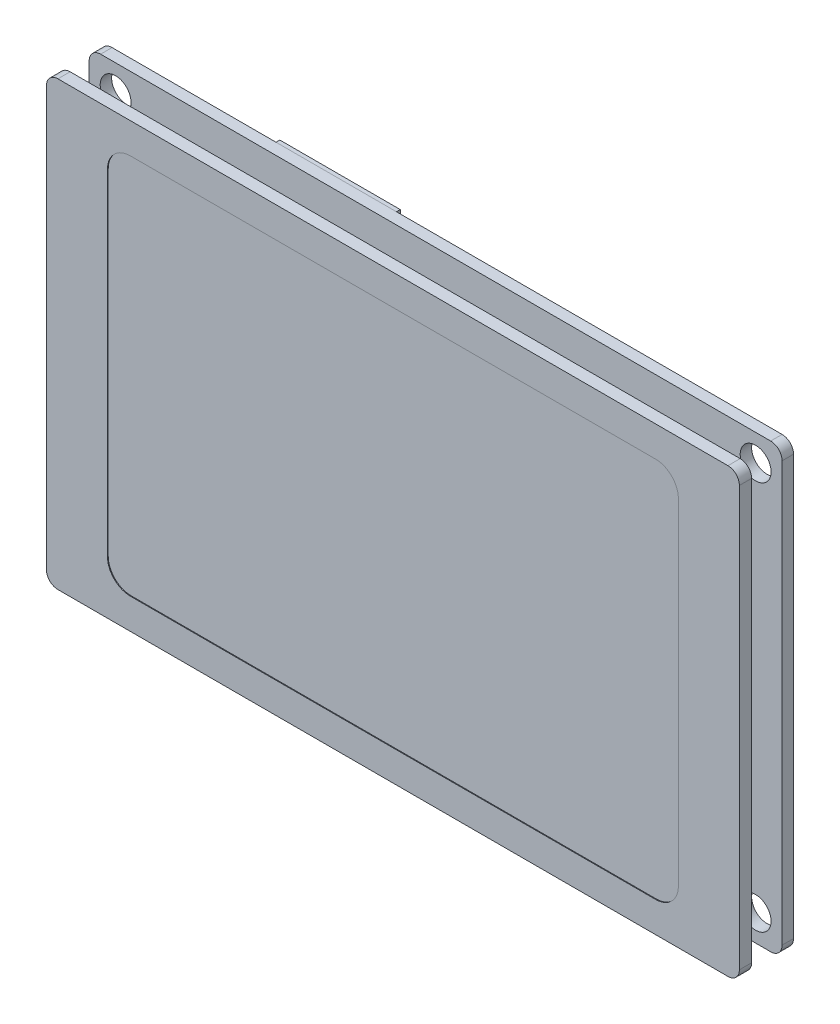
from build123d import *

# Parameters (mm, degrees)
SKETCH1_W             = 90.87
SKETCH1_H             = 58.01
SKETCH1_R             = 2.025
BOSS_EXTRUDE1_DEPTH   = 1.5
FILLET1_R             = 1.5
SKETCH2_W             = 4.5
SKETCH2_H             = 40.5
SKETCH2_W_2           = 1.5
SKETCH2_H_2           = 1.5
BOSS_EXTRUDE2_DEPTH   = 5
SKETCH2_W_3           = 40.5
SKETCH2_H_3           = 4.5
BOSS_EXTRUDE2_2_DEPTH = 5
SKETCH3_W             = 15.8
SKETCH3_H             = 31.3
BOSS_EXTRUDE3_DEPTH   = 0.5
BOSS_EXTRUDE4_DEPTH   = 2.7
SKETCH5_W             = 80
SKETCH5_H             = 45
BOSS_EXTRUDE5_DEPTH   = 4
BOSS_EXTRUDE6_DEPTH   = 1.6
CUT_EXTRUDE1_DEPTH    = 0.1


with BuildPart() as part:
    # Sketch1 → Boss-Extrude1 (new body)
    with BuildSketch(Plane.XY):
        Rectangle(SKETCH1_W, SKETCH1_H)
        with Locations((-41.965, 25.515)):
            Circle(SKETCH1_R, mode=Mode.SUBTRACT)
        with Locations(Location((-41.965, -25.515, 0), (0, 0, 180))):
            Circle(SKETCH1_R, mode=Mode.SUBTRACT)
        with Locations((41.965, -25.515)):
            Circle(SKETCH1_R, mode=Mode.SUBTRACT)
        with Locations(Location((41.965, 25.515, 0), (0, 0, 180))):
            Circle(SKETCH1_R, mode=Mode.SUBTRACT)
    extrude(amount=BOSS_EXTRUDE1_DEPTH)

    # Fillet1
    fillet1_edges = [part.edges().sort_by_distance(p)[0] for p in [
        (45.435, -29.005, 0.75),
        (-45.435, -29.005, 0.75),
        (-45.435, 29.005, 0.75),
        (45.435, 29.005, 0.75),
    ]]
    fillet(fillet1_edges, radius=FILLET1_R)


with BuildPart() as body_2:
    # Sketch2 → Boss-Extrude2 (new body)
    with BuildSketch(Plane(origin=(0, 0, 0), x_dir=(-1, 0, 0), z_dir=(0, 0, -1))):
        with Locations((40.185, 0.245)):
            Rectangle(SKETCH2_W, SKETCH2_H)
        with Locations((41.185, 19.245)):
            Rectangle(SKETCH2_W_2, SKETCH2_H_2, mode=Mode.SUBTRACT)
        with Locations((39.185, 19.245)):
            Rectangle(SKETCH2_W_2, SKETCH2_H_2, mode=Mode.SUBTRACT)
        with Locations((41.185, 17.245)):
            Rectangle(SKETCH2_W_2, SKETCH2_H_2, mode=Mode.SUBTRACT)
        with Locations((41.185, 15.245)):
            Rectangle(SKETCH2_W_2, SKETCH2_H_2, mode=Mode.SUBTRACT)
        with Locations((41.185, 13.245)):
            Rectangle(SKETCH2_W_2, SKETCH2_H_2, mode=Mode.SUBTRACT)
        with Locations((41.185, 11.245)):
            Rectangle(SKETCH2_W_2, SKETCH2_H_2, mode=Mode.SUBTRACT)
        with Locations((41.185, 9.245)):
            Rectangle(SKETCH2_W_2, SKETCH2_H_2, mode=Mode.SUBTRACT)
        with Locations((41.185, 7.245)):
            Rectangle(SKETCH2_W_2, SKETCH2_H_2, mode=Mode.SUBTRACT)
        with Locations((41.185, 5.245)):
            Rectangle(SKETCH2_W_2, SKETCH2_H_2, mode=Mode.SUBTRACT)
        with Locations((41.185, 3.245)):
            Rectangle(SKETCH2_W_2, SKETCH2_H_2, mode=Mode.SUBTRACT)
        with Locations((41.185, 1.245)):
            Rectangle(SKETCH2_W_2, SKETCH2_H_2, mode=Mode.SUBTRACT)
        with Locations((41.185, -0.755)):
            Rectangle(SKETCH2_W_2, SKETCH2_H_2, mode=Mode.SUBTRACT)
        with Locations((41.185, -2.755)):
            Rectangle(SKETCH2_W_2, SKETCH2_H_2, mode=Mode.SUBTRACT)
        with Locations((41.185, -4.755)):
            Rectangle(SKETCH2_W_2, SKETCH2_H_2, mode=Mode.SUBTRACT)
        with Locations((41.185, -6.755)):
            Rectangle(SKETCH2_W_2, SKETCH2_H_2, mode=Mode.SUBTRACT)
        with Locations((41.185, -8.755)):
            Rectangle(SKETCH2_W_2, SKETCH2_H_2, mode=Mode.SUBTRACT)
        with Locations((41.185, -10.755)):
            Rectangle(SKETCH2_W_2, SKETCH2_H_2, mode=Mode.SUBTRACT)
        with Locations((41.185, -12.755)):
            Rectangle(SKETCH2_W_2, SKETCH2_H_2, mode=Mode.SUBTRACT)
        with Locations((41.185, -14.755)):
            Rectangle(SKETCH2_W_2, SKETCH2_H_2, mode=Mode.SUBTRACT)
        with Locations((41.185, -16.755)):
            Rectangle(SKETCH2_W_2, SKETCH2_H_2, mode=Mode.SUBTRACT)
        with Locations((41.185, -18.755)):
            Rectangle(SKETCH2_W_2, SKETCH2_H_2, mode=Mode.SUBTRACT)
        with Locations((39.185, 17.245)):
            Rectangle(SKETCH2_W_2, SKETCH2_H_2, mode=Mode.SUBTRACT)
        with Locations((39.185, 15.245)):
            Rectangle(SKETCH2_W_2, SKETCH2_H_2, mode=Mode.SUBTRACT)
        with Locations((39.185, 13.245)):
            Rectangle(SKETCH2_W_2, SKETCH2_H_2, mode=Mode.SUBTRACT)
        with Locations((39.185, 11.245)):
            Rectangle(SKETCH2_W_2, SKETCH2_H_2, mode=Mode.SUBTRACT)
        with Locations((39.185, 9.245)):
            Rectangle(SKETCH2_W_2, SKETCH2_H_2, mode=Mode.SUBTRACT)
        with Locations((39.185, 7.245)):
            Rectangle(SKETCH2_W_2, SKETCH2_H_2, mode=Mode.SUBTRACT)
        with Locations((39.185, 5.245)):
            Rectangle(SKETCH2_W_2, SKETCH2_H_2, mode=Mode.SUBTRACT)
        with Locations((39.185, 3.245)):
            Rectangle(SKETCH2_W_2, SKETCH2_H_2, mode=Mode.SUBTRACT)
        with Locations((39.185, 1.245)):
            Rectangle(SKETCH2_W_2, SKETCH2_H_2, mode=Mode.SUBTRACT)
        with Locations((39.185, -0.755)):
            Rectangle(SKETCH2_W_2, SKETCH2_H_2, mode=Mode.SUBTRACT)
        with Locations((39.185, -2.755)):
            Rectangle(SKETCH2_W_2, SKETCH2_H_2, mode=Mode.SUBTRACT)
        with Locations((39.185, -4.755)):
            Rectangle(SKETCH2_W_2, SKETCH2_H_2, mode=Mode.SUBTRACT)
        with Locations((39.185, -6.755)):
            Rectangle(SKETCH2_W_2, SKETCH2_H_2, mode=Mode.SUBTRACT)
        with Locations((39.185, -8.755)):
            Rectangle(SKETCH2_W_2, SKETCH2_H_2, mode=Mode.SUBTRACT)
        with Locations((39.185, -10.755)):
            Rectangle(SKETCH2_W_2, SKETCH2_H_2, mode=Mode.SUBTRACT)
        with Locations((39.185, -12.755)):
            Rectangle(SKETCH2_W_2, SKETCH2_H_2, mode=Mode.SUBTRACT)
        with Locations((39.185, -14.755)):
            Rectangle(SKETCH2_W_2, SKETCH2_H_2, mode=Mode.SUBTRACT)
        with Locations((39.185, -16.755)):
            Rectangle(SKETCH2_W_2, SKETCH2_H_2, mode=Mode.SUBTRACT)
        with Locations((39.185, -18.755)):
            Rectangle(SKETCH2_W_2, SKETCH2_H_2, mode=Mode.SUBTRACT)
    extrude(amount=BOSS_EXTRUDE2_DEPTH)


with BuildPart() as body_3:
    # Sketch2 → Boss-Extrude2 2 (new body)
    with BuildSketch(Plane(origin=(0, 0, 0), x_dir=(-1, 0, 0), z_dir=(0, 0, -1))):
        with Locations((0.185, -23.755)):
            Rectangle(SKETCH2_W_3, SKETCH2_H_3)
        with Locations((-16.815, -22.755)):
            Rectangle(SKETCH2_W_2, SKETCH2_H_2, mode=Mode.SUBTRACT)
        with Locations((-18.815, -22.755)):
            Rectangle(SKETCH2_W_2, SKETCH2_H_2, mode=Mode.SUBTRACT)
        with Locations((-14.815, -22.755)):
            Rectangle(SKETCH2_W_2, SKETCH2_H_2, mode=Mode.SUBTRACT)
        with Locations((-12.815, -22.755)):
            Rectangle(SKETCH2_W_2, SKETCH2_H_2, mode=Mode.SUBTRACT)
        with Locations((-10.815, -22.755)):
            Rectangle(SKETCH2_W_2, SKETCH2_H_2, mode=Mode.SUBTRACT)
        with Locations((-8.815, -22.755)):
            Rectangle(SKETCH2_W_2, SKETCH2_H_2, mode=Mode.SUBTRACT)
        with Locations((-6.815, -22.755)):
            Rectangle(SKETCH2_W_2, SKETCH2_H_2, mode=Mode.SUBTRACT)
        with Locations((-4.815, -22.755)):
            Rectangle(SKETCH2_W_2, SKETCH2_H_2, mode=Mode.SUBTRACT)
        with Locations((-2.815, -22.755)):
            Rectangle(SKETCH2_W_2, SKETCH2_H_2, mode=Mode.SUBTRACT)
        with Locations((-0.815, -22.755)):
            Rectangle(SKETCH2_W_2, SKETCH2_H_2, mode=Mode.SUBTRACT)
        with Locations((1.185, -22.755)):
            Rectangle(SKETCH2_W_2, SKETCH2_H_2, mode=Mode.SUBTRACT)
        with Locations((3.185, -22.755)):
            Rectangle(SKETCH2_W_2, SKETCH2_H_2, mode=Mode.SUBTRACT)
        with Locations((5.185, -22.755)):
            Rectangle(SKETCH2_W_2, SKETCH2_H_2, mode=Mode.SUBTRACT)
        with Locations((7.185, -22.755)):
            Rectangle(SKETCH2_W_2, SKETCH2_H_2, mode=Mode.SUBTRACT)
        with Locations((9.185, -22.755)):
            Rectangle(SKETCH2_W_2, SKETCH2_H_2, mode=Mode.SUBTRACT)
        with Locations((11.185, -22.755)):
            Rectangle(SKETCH2_W_2, SKETCH2_H_2, mode=Mode.SUBTRACT)
        with Locations((13.185, -22.755)):
            Rectangle(SKETCH2_W_2, SKETCH2_H_2, mode=Mode.SUBTRACT)
        with Locations((15.185, -22.755)):
            Rectangle(SKETCH2_W_2, SKETCH2_H_2, mode=Mode.SUBTRACT)
        with Locations((17.185, -22.755)):
            Rectangle(SKETCH2_W_2, SKETCH2_H_2, mode=Mode.SUBTRACT)
        with Locations((19.185, -22.755)):
            Rectangle(SKETCH2_W_2, SKETCH2_H_2, mode=Mode.SUBTRACT)
        with Locations((-16.815, -24.755)):
            Rectangle(SKETCH2_W_2, SKETCH2_H_2, mode=Mode.SUBTRACT)
        with Locations((-14.815, -24.755)):
            Rectangle(SKETCH2_W_2, SKETCH2_H_2, mode=Mode.SUBTRACT)
        with Locations((-12.815, -24.755)):
            Rectangle(SKETCH2_W_2, SKETCH2_H_2, mode=Mode.SUBTRACT)
        with Locations((-10.815, -24.755)):
            Rectangle(SKETCH2_W_2, SKETCH2_H_2, mode=Mode.SUBTRACT)
        with Locations((-8.815, -24.755)):
            Rectangle(SKETCH2_W_2, SKETCH2_H_2, mode=Mode.SUBTRACT)
        with Locations((-6.815, -24.755)):
            Rectangle(SKETCH2_W_2, SKETCH2_H_2, mode=Mode.SUBTRACT)
        with Locations((-4.815, -24.755)):
            Rectangle(SKETCH2_W_2, SKETCH2_H_2, mode=Mode.SUBTRACT)
        with Locations((-2.815, -24.755)):
            Rectangle(SKETCH2_W_2, SKETCH2_H_2, mode=Mode.SUBTRACT)
        with Locations((-0.815, -24.755)):
            Rectangle(SKETCH2_W_2, SKETCH2_H_2, mode=Mode.SUBTRACT)
        with Locations((1.185, -24.755)):
            Rectangle(SKETCH2_W_2, SKETCH2_H_2, mode=Mode.SUBTRACT)
        with Locations((3.185, -24.755)):
            Rectangle(SKETCH2_W_2, SKETCH2_H_2, mode=Mode.SUBTRACT)
        with Locations((5.185, -24.755)):
            Rectangle(SKETCH2_W_2, SKETCH2_H_2, mode=Mode.SUBTRACT)
        with Locations((7.185, -24.755)):
            Rectangle(SKETCH2_W_2, SKETCH2_H_2, mode=Mode.SUBTRACT)
        with Locations((9.185, -24.755)):
            Rectangle(SKETCH2_W_2, SKETCH2_H_2, mode=Mode.SUBTRACT)
        with Locations((11.185, -24.755)):
            Rectangle(SKETCH2_W_2, SKETCH2_H_2, mode=Mode.SUBTRACT)
        with Locations((13.185, -24.755)):
            Rectangle(SKETCH2_W_2, SKETCH2_H_2, mode=Mode.SUBTRACT)
        with Locations((15.185, -24.755)):
            Rectangle(SKETCH2_W_2, SKETCH2_H_2, mode=Mode.SUBTRACT)
        with Locations((17.185, -24.755)):
            Rectangle(SKETCH2_W_2, SKETCH2_H_2, mode=Mode.SUBTRACT)
        with Locations((19.185, -24.755)):
            Rectangle(SKETCH2_W_2, SKETCH2_H_2, mode=Mode.SUBTRACT)
        with Locations((-18.815, -24.755)):
            Rectangle(SKETCH2_W_2, SKETCH2_H_2, mode=Mode.SUBTRACT)
    extrude(amount=BOSS_EXTRUDE2_2_DEPTH)


with BuildPart() as body_4:
    # Sketch3 → Boss-Extrude3 (new body)
    with BuildSketch(Plane(origin=(0, 0, 0), x_dir=(-1, 0, 0), z_dir=(0, 0, -1))):
        with Locations((14.535, 13.355)):
            Rectangle(SKETCH3_W, SKETCH3_H)
    extrude(amount=BOSS_EXTRUDE3_DEPTH)


with BuildPart() as body_5:
    # Sketch4 → Boss-Extrude4 (new body)
    with BuildSketch(Plane(origin=(0, 0, -0.5), x_dir=(-1, 0, 0), z_dir=(0, 0, -1))):
        Polygon((6.635, -2.295), (22.435, -2.295), (22.435, 17.705), (15.935, 17.705), (15.935, 21.705), (6.635, 21.705), align=None)
    extrude(amount=BOSS_EXTRUDE4_DEPTH)


with BuildPart() as body_6:
    # Sketch5 → Boss-Extrude5 (new body)
    with BuildSketch(Plane.XY.offset(1.5)):
        Rectangle(SKETCH5_W, SKETCH5_H)
    extrude(amount=BOSS_EXTRUDE5_DEPTH)


with BuildPart() as body_7:
    # Sketch6 → Boss-Extrude6 (new body)
    with BuildSketch(Plane.XY.offset(5.5)):
        with BuildLine():
            Line((-43.935, -29.005), (43.935, -29.005))
            ThreePointArc((43.935, -29.005), (44.995660172, -28.565660172), (45.435, -27.505))
            Line((45.435, -27.505), (45.435, 27.505))
            ThreePointArc((45.435, 27.505), (44.995660172, 28.565660172), (43.935, 29.005))
            Line((43.935, 29.005), (-43.935, 29.005))
            ThreePointArc((-43.935, 29.005), (-44.995660172, 28.565660172), (-45.435, 27.505))
            Line((-45.435, 27.505), (-45.435, -27.505))
            ThreePointArc((-45.435, -27.505), (-44.995660172, -28.565660172), (-43.935, -29.005))
        make_face()
    extrude(amount=BOSS_EXTRUDE6_DEPTH)

    # Sketch7 → Cut-Extrude1 (cut)
    with BuildSketch(Plane.XY.offset(7.1)):
        with BuildLine():
            Line((-34.435, 25.005), (34.435, 25.005))
            ThreePointArc((34.435, 25.005), (36.556320344, 24.126320344), (37.435, 22.005))
            Line((37.435, 22.005), (37.435, -22.005))
            ThreePointArc((37.435, -22.005), (36.556320344, -24.126320344), (34.435, -25.005))
            Line((34.435, -25.005), (-34.435, -25.005))
            ThreePointArc((-34.435, -25.005), (-36.556320344, -24.126320344), (-37.435, -22.005))
            Line((-37.435, -22.005), (-37.435, 22.005))
            ThreePointArc((-37.435, 22.005), (-36.556320344, 24.126320344), (-34.435, 25.005))
        make_face()
    extrude(amount=-CUT_EXTRUDE1_DEPTH, mode=Mode.SUBTRACT)


solid = Compound([part.part, body_2.part, body_3.part, body_4.part, body_5.part, body_6.part, body_7.part])
